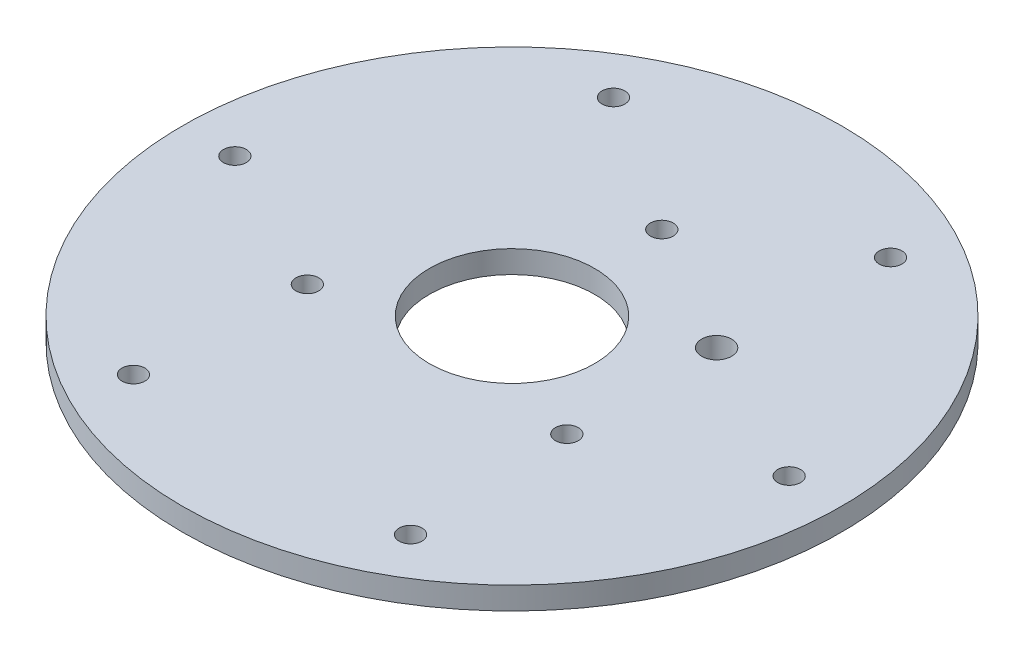
from build123d import *

# Parameters (mm, degrees)
SKETCH_1_R      = 44
SKETCH_1_R_2    = 1.525
SKETCH_1_R_3    = 11.025
SKETCH_1_R_4    = 2
EXTRUDE_1_DEPTH = 3


with BuildPart() as part:
    # 草图1 → 凸台-拉伸1 (new body)
    with BuildSketch(Plane(origin=(0, 0, 0), x_dir=(1, 0, 0), z_dir=(0, 1, 0))):
        with Locations(Location((0, 0, 0), (0, 0, 270))):
            Circle(SKETCH_1_R)
        with Locations(Location((37, 0, 0), (0, 0, 270))):
            Circle(SKETCH_1_R_2, mode=Mode.SUBTRACT)
        with Locations(Location((18.5, -32.04293994, 0), (0, 0, 270))):
            Circle(SKETCH_1_R_2, mode=Mode.SUBTRACT)
        with Locations(Location((-18.5, -32.04293994, 0), (0, 0, 270))):
            Circle(SKETCH_1_R_2, mode=Mode.SUBTRACT)
        with Locations(Location((-37, 0, 0), (0, 0, 270))):
            Circle(SKETCH_1_R_2, mode=Mode.SUBTRACT)
        with Locations(Location((-18.5, 32.04293994, 0), (0, 0, 270))):
            Circle(SKETCH_1_R_2, mode=Mode.SUBTRACT)
        with Locations(Location((18.5, 32.04293994, 0), (0, 0, 270))):
            Circle(SKETCH_1_R_2, mode=Mode.SUBTRACT)
        with Locations(Location((0, 0, 0), (0, 0, 270))):
            Circle(SKETCH_1_R_3, mode=Mode.SUBTRACT)
        with Locations(Location((0, 20, 0), (0, 0, 270))):
            Circle(SKETCH_1_R_2, mode=Mode.SUBTRACT)
        with Locations(Location((17.320508076, -10, 0), (0, 0, 270))):
            Circle(SKETCH_1_R_2, mode=Mode.SUBTRACT)
        with Locations(Location((-17.320508076, -10, 0), (0, 0, 270))):
            Circle(SKETCH_1_R_2, mode=Mode.SUBTRACT)
        with Locations(Location((17.320508076, 10, 0), (0, 0, 270))):
            Circle(SKETCH_1_R_4, mode=Mode.SUBTRACT)
    extrude(amount=EXTRUDE_1_DEPTH)


solid = part.part
